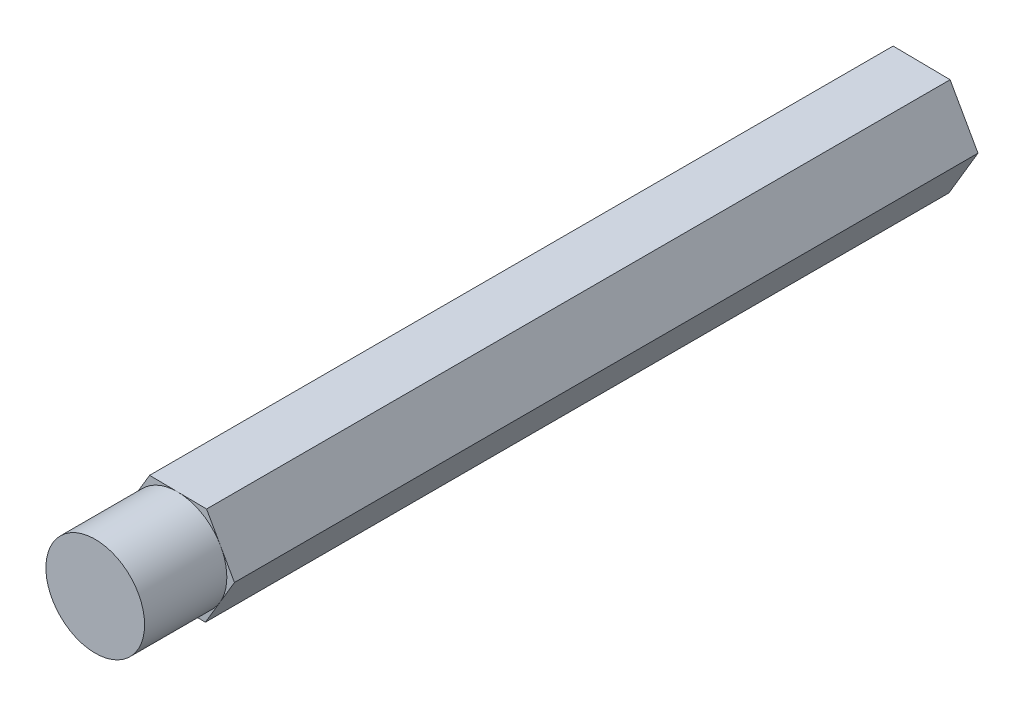
from build123d import *

# Parameters (mm, degrees)
BOSS_EXTRUDE1_DEPTH = 79.7052
SKETCH5_R           = 5.499261314
SKETCH5_R_2         = 4.7625
CUT_EXTRUDE2_DEPTH  = 7.9375


with BuildPart() as part:
    # Sketch1 → Boss-Extrude1 (new body)
    with BuildSketch(Plane.XY):
        Polygon((2.806881074, 4.728984419), (-2.691980104, 4.795322525), (-5.498861178, 0.066338106), (-2.806881074, -4.728984419), (2.691980104, -4.795322525), (5.498861178, -0.066338106), align=None)
    extrude(amount=BOSS_EXTRUDE1_DEPTH)

    # Sketch5 → Cut-Extrude2 (cut)
    with BuildSketch(Plane.XY.offset(79.7052)):
        Circle(SKETCH5_R)
        Circle(SKETCH5_R_2, mode=Mode.SUBTRACT)
    extrude(amount=-CUT_EXTRUDE2_DEPTH, mode=Mode.SUBTRACT)


solid = part.part
